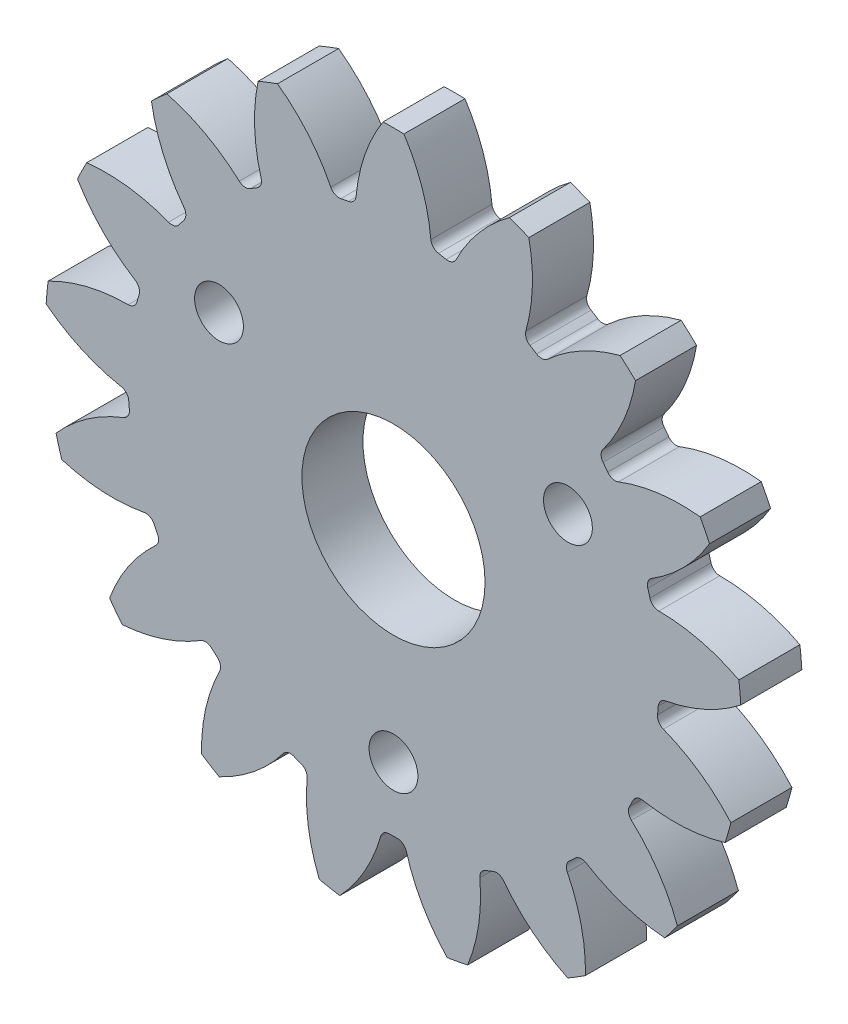
from build123d import *

# Parameters (mm, degrees)
SKETCH_1_R                       = 21.75
EXTRUDE_1_DEPTH                  = 5
EXTRUDE_2_DEPTH                  = 5
FILLET_1_R                       = 0.75
CUT_EXTRUDE_1_REACH              = 38.198
SKETCH_2_R                       = 7.5
SKETCH_2_R_2                     = 2
PATTERN_CIRCULAR_1_COUNT         = 17
FILLET_1_OF_PATTERN_CIRCULAR_1_R = 0.75


with BuildPart() as part:
    # 스케치1 → 보스-돌출1 (new body)
    with BuildSketch(Plane.XY):
        Circle(SKETCH_1_R)
    extrude(amount=EXTRUDE_1_DEPTH)

    # 스케치1<3> → 보스-돌출2 (add)
    with BuildSketch(Plane.XY):
        with BuildLine():
            ThreePointArc((-3.105, 21.527226366), (0, 21.75), (3.105, 21.527226366))
            ThreePointArc((3.105, 21.527226366), (2.433941683, 25.153948772), (0.855, 28.487172113))
            ThreePointArc((0.855, 28.487172113), (0, 28.5), (-0.855, 28.487172113))
            ThreePointArc((-0.855, 28.487172113), (-2.433941683, 25.153948772), (-3.105, 21.527226366))
        make_face()
    extrude_2 = extrude(amount=EXTRUDE_2_DEPTH)

    # 필렛1
    fillet_1_edges = [part.edges().sort_by_distance(p)[0] for p in [
        (3.105, 21.527226366, 2.5),
        (-3.105, 21.527226366, 2.5),
    ]]
    fillet(fillet_1_edges, radius=FILLET_1_R)

    # 스케치2 → 컷-돌출1 (cut, up to next)
    with BuildSketch(Plane.XY.offset(5), mode=Mode.PRIVATE) as cut_extrude_1_sk1:
        Circle(SKETCH_2_R)
    cut_extrude_1_tool1 = extrude(cut_extrude_1_sk1.sketch, amount=-CUT_EXTRUDE_1_REACH, mode=Mode.PRIVATE) & part.part
    # 스케치2 → 컷-돌출1 (cut, up to next)
    with BuildSketch(Plane.XY.offset(5), mode=Mode.PRIVATE) as cut_extrude_1_sk2:
        with Locations((0, -16.5)):
            Circle(SKETCH_2_R_2)
    cut_extrude_1_tool2 = extrude(cut_extrude_1_sk2.sketch, amount=-CUT_EXTRUDE_1_REACH, mode=Mode.PRIVATE) & part.part
    # 스케치2 → 컷-돌출1 (cut, up to next)
    with BuildSketch(Plane.XY.offset(5), mode=Mode.PRIVATE) as cut_extrude_1_sk3:
        with Locations((-14.289419162, 8.25)):
            Circle(SKETCH_2_R_2)
    cut_extrude_1_tool3 = extrude(cut_extrude_1_sk3.sketch, amount=-CUT_EXTRUDE_1_REACH, mode=Mode.PRIVATE) & part.part
    # 스케치2 → 컷-돌출1 (cut, up to next)
    with BuildSketch(Plane.XY.offset(5), mode=Mode.PRIVATE) as cut_extrude_1_sk4:
        with Locations((14.289419162, 8.25)):
            Circle(SKETCH_2_R_2)
    cut_extrude_1_tool4 = extrude(cut_extrude_1_sk4.sketch, amount=-CUT_EXTRUDE_1_REACH, mode=Mode.PRIVATE) & part.part
    add(cut_extrude_1_tool1.solids().sort_by_distance((0, 0, 5))[0], mode=Mode.SUBTRACT)
    add(cut_extrude_1_tool2.solids().sort_by_distance((0, -16.5, 5))[0], mode=Mode.SUBTRACT)
    add(cut_extrude_1_tool3.solids().sort_by_distance((-14.289419, 8.25, 5))[0], mode=Mode.SUBTRACT)
    add(cut_extrude_1_tool4.solids().sort_by_distance((14.289419, 8.25, 5))[0], mode=Mode.SUBTRACT)

    # 원형 패턴1: 보스-돌출2 ×17 about axis
    pattern_circular_1_axis = Axis((0, 0, -0.001), (0, 0, 1))
    for i in range(1, PATTERN_CIRCULAR_1_COUNT):
        add(extrude_2.rotate(pattern_circular_1_axis, i * 360 / PATTERN_CIRCULAR_1_COUNT))

    # 필렛1 of 원형 패턴1
    fillet_1_of_pattern_circular_1_edges = [part.edges().sort_by_distance(p)[0] for p in [
        (-4.881204848, 21.195196136, 2.5),
        (-10.671857393, 18.951885389, 2.5),
        (-12.208175934, 18.000637221, 2.5),
        (-16.79742131, 13.816987274, 2.5),
        (-17.886365213, 12.374992504, 2.5),
        (-20.654400402, 6.816028465, 2.5),
        (-21.148901757, 5.078036478, 2.5),
        (-21.721888269, -1.105472757, 2.5),
        (-21.555161929, -2.904736513, 2.5),
        (-19.855714761, -8.877673757, 2.5),
        (-19.050278041, -10.495208742, 2.5),
        (-15.307916949, -15.450895724, 2.5),
        (-13.972548543, -16.668244875, 2.5),
        (-8.69270013, -19.937388607, 2.5),
        (-7.007748939, -20.590142175, 2.5),
        (-0.90348599, -21.731226681, 2.5),
        (0.90348599, -21.731226681, 2.5),
        (7.007748939, -20.590142175, 2.5),
        (8.69270013, -19.937388607, 2.5),
        (13.972548543, -16.668244875, 2.5),
        (15.307916949, -15.450895724, 2.5),
        (19.050278041, -10.495208742, 2.5),
        (19.855714761, -8.877673757, 2.5),
        (21.555161929, -2.904736513, 2.5),
        (21.721888269, -1.105472757, 2.5),
        (21.148901757, 5.078036478, 2.5),
        (20.654400402, 6.816028465, 2.5),
        (17.886365213, 12.374992504, 2.5),
        (16.79742131, 13.816987274, 2.5),
        (12.208175934, 18.000637221, 2.5),
        (10.671857393, 18.951885389, 2.5),
        (4.881204848, 21.195196136, 2.5),
    ]]
    fillet(fillet_1_of_pattern_circular_1_edges, radius=FILLET_1_OF_PATTERN_CIRCULAR_1_R)


solid = part.part
